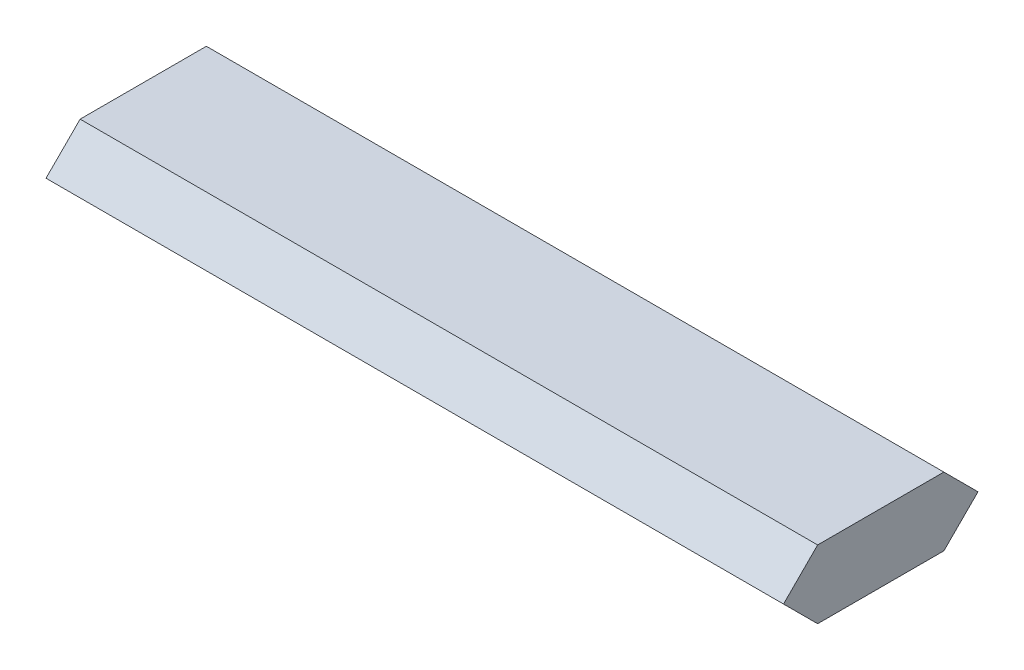
from build123d import *

# Parameters (mm, degrees)
BOSS_EXTRUDE1_DEPTH = 15.875


with BuildPart() as part:
    # Sketch2 → Boss-Extrude1 (new, symmetric)
    with BuildSketch(Plane(origin=(0, 0, 0), x_dir=(0, 0, -1), z_dir=(1, 0, 0))):
        Polygon((-2.7172665, 2.937793595), (-4.186163298, 1.468896798), (-2.7172665, 0), (2.7172665, 0), (4.186163298, 1.468896798), (2.7172665, 2.937793595), align=None)
    extrude(amount=BOSS_EXTRUDE1_DEPTH, both=True)


solid = part.part
